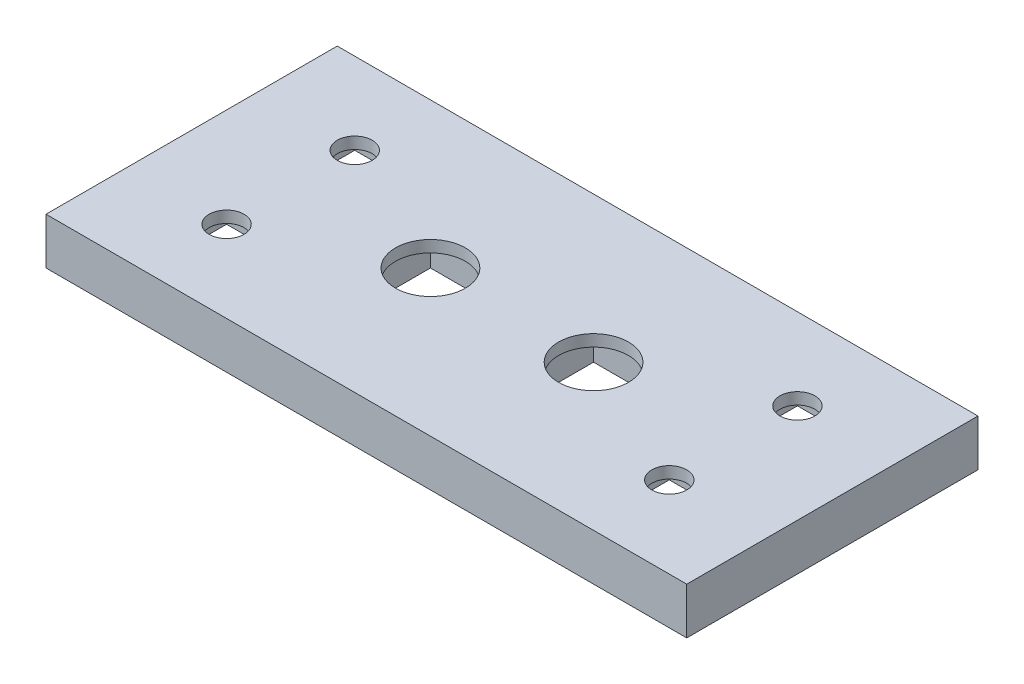
from build123d import *

# Parameters (mm, degrees)
SKETCH1_W           = 55
SKETCH1_H           = 25
BOSS_EXTRUDE1_DEPTH = 4
SKETCH1_3_W         = 8
SKETCH1_3_H         = 8
SKETCH1_3_R         = 1.5
SKETCH1_3_R_2       = 3
CUT_EXTRUDE3_DEPTH  = 3
SKETCH1_4_R         = 1.5
SKETCH1_4_R_2       = 3
CUT_EXTRUDE4_DEPTH  = 61.547502013


with BuildPart() as part:
    # Sketch1 → Boss-Extrude1 (new body)
    with BuildSketch(Plane(origin=(0, 0, 0), x_dir=(1, 0, 0), z_dir=(0, 1, 0))):
        with Locations((27.5, 12.5)):
            Rectangle(SKETCH1_W, SKETCH1_H)
    extrude(amount=BOSS_EXTRUDE1_DEPTH)

    # Sketch1<3> → Cut-Extrude3 (cut)
    # profile 1 of 6: a face of its own
    with BuildSketch(Plane(origin=(0, 0, 0), x_dir=(1, 0, 0), z_dir=(0, 1, 0))):
        with Locations((8.5, 7)):
            Rectangle(SKETCH1_3_W, SKETCH1_3_H)
        with Locations((8.5, 7)):
            Circle(SKETCH1_3_R, mode=Mode.SUBTRACT)
    # profile 2 of 6: a face of its own
    with BuildSketch(Plane(origin=(0, 0, 0), x_dir=(1, 0, 0), z_dir=(0, 1, 0))):
        with Locations((20.5, 12.5)):
            Rectangle(SKETCH1_3_W, SKETCH1_3_H)
    # profile 3 of 6: a face of its own
    with BuildSketch(Plane(origin=(0, 0, 0), x_dir=(1, 0, 0), z_dir=(0, 1, 0))):
        with Locations((8.5, 18)):
            Rectangle(SKETCH1_3_W, SKETCH1_3_H)
    # profile 4 of 6: a face of its own
    with BuildSketch(Plane(origin=(0, 0, 0), x_dir=(1, 0, 0), z_dir=(0, 1, 0))):
        with Locations((34.5, 12.5)):
            Rectangle(SKETCH1_3_W, SKETCH1_3_H)
        with Locations((34.5, 12.5)):
            Circle(SKETCH1_3_R_2, mode=Mode.SUBTRACT)
    # profile 5 of 6: a face of its own
    with BuildSketch(Plane(origin=(0, 0, 0), x_dir=(1, 0, 0), z_dir=(0, 1, 0))):
        with Locations((46.5, 7)):
            Rectangle(SKETCH1_3_W, SKETCH1_3_H)
        with Locations((46.5, 7)):
            Circle(SKETCH1_3_R, mode=Mode.SUBTRACT)
    # profile 6 of 6: a face of its own
    with BuildSketch(Plane(origin=(0, 0, 0), x_dir=(1, 0, 0), z_dir=(0, 1, 0))):
        with Locations((46.5, 18)):
            Rectangle(SKETCH1_3_W, SKETCH1_3_H)
        with Locations((46.5, 18)):
            Circle(SKETCH1_3_R, mode=Mode.SUBTRACT)
    extrude(amount=CUT_EXTRUDE3_DEPTH, mode=Mode.SUBTRACT)

    # Sketch1<4> → Cut-Extrude4 (cut, through all)
    with BuildSketch(Plane(origin=(0, 0, 0), x_dir=(1, 0, 0), z_dir=(0, 1, 0))):
        with Locations((8.5, 18)):
            Circle(SKETCH1_4_R)
        with Locations((20.5, 12.5)):
            Circle(SKETCH1_4_R_2)
        with Locations((8.5, 7)):
            Circle(SKETCH1_4_R)
        with Locations((34.5, 12.5)):
            Circle(SKETCH1_4_R_2)
        with Locations((46.5, 7)):
            Circle(SKETCH1_4_R)
        with Locations((46.5, 18)):
            Circle(SKETCH1_4_R)
    extrude(amount=CUT_EXTRUDE4_DEPTH, mode=Mode.SUBTRACT)


solid = part.part
